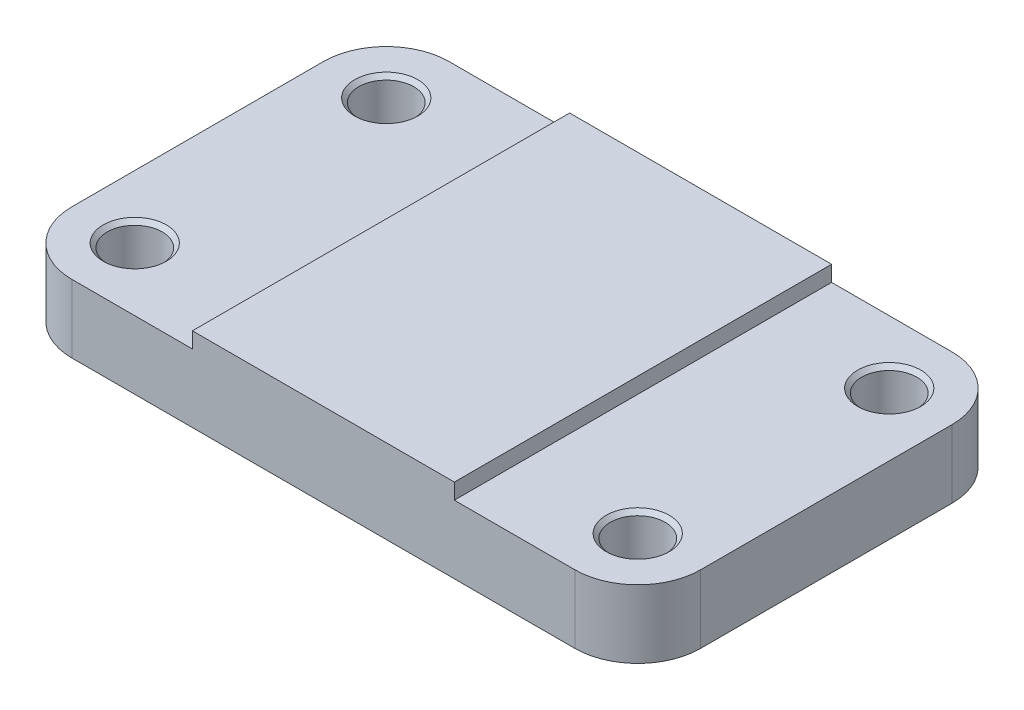
from build123d import *

# Parameters (mm, degrees)
BOSS_EXTRUDE1_DEPTH              = 36
BOSS_EXTRUDE1_DEPTH_BACK         = 36
FILLET1_R                        = 12
M12X1_5_TAPPED_HOLE1_D           = 10.5
M12X1_5_TAPPED_HOLE1_CSINK_D     = 12.05
M12X1_5_TAPPED_HOLE1_CSINK_ANGLE = 90


with BuildPart() as part:
    # Sketch1 → Boss-Extrude1 (new, two sides: drawn at the far end of the back side and taken through both)
    with BuildSketch(Plane.XY.offset(-BOSS_EXTRUDE1_DEPTH_BACK)):
        Polygon((-60, 6.5), (-60, -6.5), (60, -6.5), (60, 6.5), (25, 6.5), (25, 9.5), (-25, 9.5), (-25, 6.5), align=None)
    extrude(amount=BOSS_EXTRUDE1_DEPTH + BOSS_EXTRUDE1_DEPTH_BACK)

    # Fillet1
    fillet1_edges = [part.edges().sort_by_distance(p)[0] for p in [
        (-60, 0, -36),
        (-60, 0, 36),
        (60, 0, -36),
        (60, 0, 36),
    ]]
    fillet(fillet1_edges, radius=FILLET1_R)

    # M12x1.5 Tapped Hole1 (through all)
    with Locations(Plane(origin=(0, 6.5, 0), x_dir=(1, 0, 0), z_dir=(0, 1, 0))):
        with Locations((-48, -24), (-48, 24), (48, 24), (48, -24)):
            CounterSinkHole(M12X1_5_TAPPED_HOLE1_D / 2, M12X1_5_TAPPED_HOLE1_CSINK_D / 2, counter_sink_angle=M12X1_5_TAPPED_HOLE1_CSINK_ANGLE)


solid = part.part
